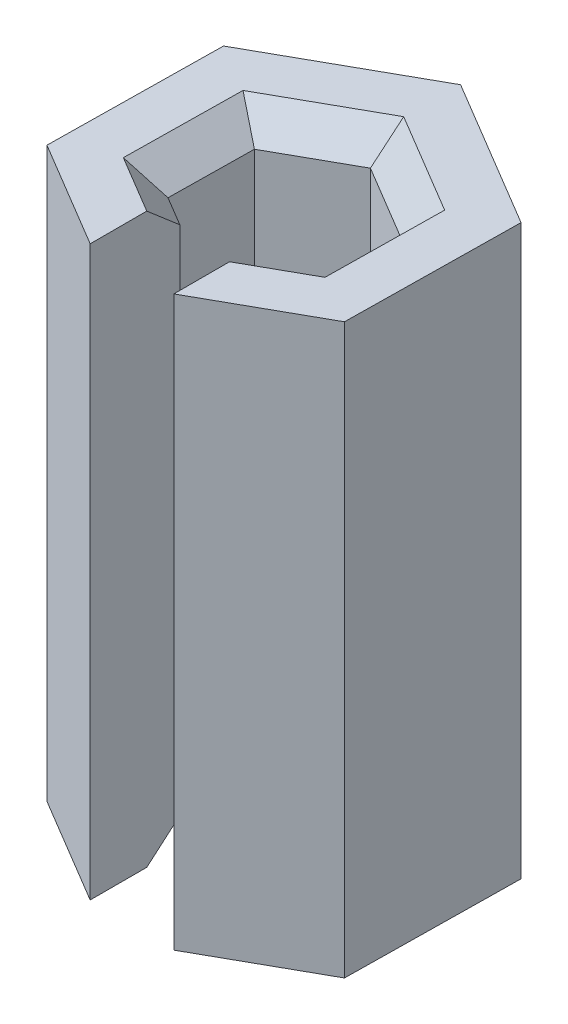
from build123d import *

# Parameters (mm, degrees)
BOSS_EXTRUDE1_DEPTH = 20
CHAMFER1_SIZE       = 1
SKETCH2_W           = 3
SKETCH2_H           = 5.519803574
CUT_EXTRUDE1_DEPTH  = 26


with BuildPart() as part:
    # Sketch1 → Boss-Extrude1 (new body)
    with BuildSketch(Plane(origin=(0, 0, 0), x_dir=(1, 0, 0), z_dir=(0, 1, 0))):
        Polygon((0.084907706, 6.13), (-5.266281872, 3.13853223), (-5.351189578, -2.99146777), (-0.084907706, -6.13), (5.266281872, -3.13853223), (5.351189578, 2.99146777), align=None)
        Polygon((0.041549541, 2.999712259), (-2.57705225, 1.535839087), (-2.618601791, -1.463873171), (-0.041549541, -2.999712259), (2.57705225, -1.535839087), (2.618601791, 1.463873171), align=None, mode=Mode.SUBTRACT)
    extrude(amount=BOSS_EXTRUDE1_DEPTH)

    # Chamfer1
    chamfer1_edges = [part.edges().sort_by_distance(p)[0] for p in [
        (1.330075666, 0, -2.231792715),
        (-1.267751354, 0, -2.267775673),
        (-2.59782702, 0, -0.035982958),
        (-1.330075666, 0, 2.231792715),
        (1.267751354, 0, 2.267775673),
        (2.59782702, 0, 0.035982958),
        (1.330075666, 20, -2.231792715),
        (-1.267751354, 20, -2.267775673),
        (-2.59782702, 20, -0.035982958),
        (-1.330075666, 20, 2.231792715),
        (1.267751354, 20, 2.267775673),
        (2.59782702, 20, 0.035982958),
    ]]
    chamfer(chamfer1_edges, length=CHAMFER1_SIZE)

    # Sketch2 → Cut-Extrude1 (cut)
    with BuildSketch(Plane(origin=(0, 20, 0), x_dir=(1, 0, 0), z_dir=(0, 1, 0))):
        with Locations((-0.084907706, -4.416905982)):
            Rectangle(SKETCH2_W, SKETCH2_H)
    extrude(amount=-CUT_EXTRUDE1_DEPTH, mode=Mode.SUBTRACT)


solid = part.part
